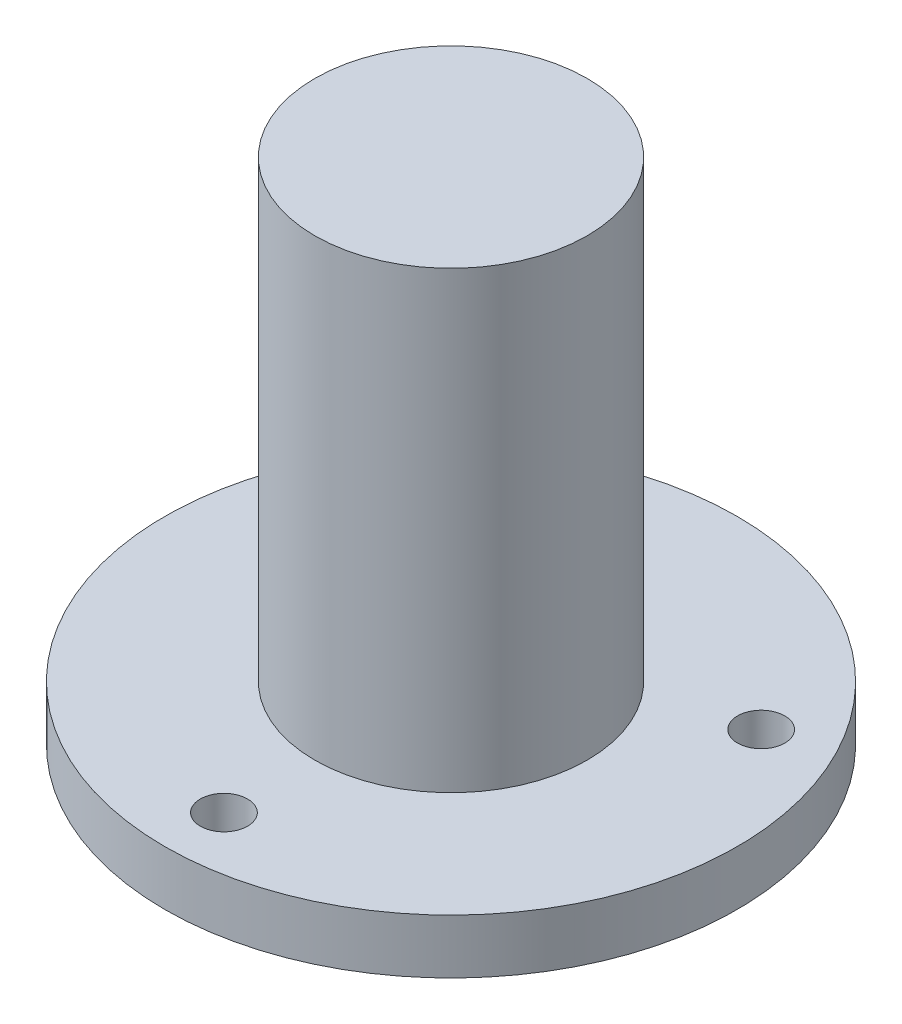
from build123d import *

# Parameters (mm, degrees)
SKETCH_1_R          = 31.5
EXTRUDE_1_DEPTH     = 6
SKETCH_2_R          = 15
EXTRUDE_2_DEPTH     = 50
SKETCH_3_R          = 2.6
CUT_EXTRUDE_1_DEPTH = 72.557669051


with BuildPart() as part:
    # 草图1 → 凸台-拉伸1 (new body)
    with BuildSketch(Plane(origin=(0, 0, 0), x_dir=(1, 0, 0), z_dir=(0, 1, 0))):
        with Locations(Location((0, 0, 0), (0, 0, 270))):
            Circle(SKETCH_1_R)
    extrude(amount=EXTRUDE_1_DEPTH)

    # 草图2 → 凸台-拉伸2 (add)
    with BuildSketch(Plane(origin=(0, 6, 0), x_dir=(1, 0, 0), z_dir=(0, 1, 0))):
        with Locations(Location((0, 0, 0), (0, 0, 270))):
            Circle(SKETCH_2_R)
    extrude(amount=EXTRUDE_2_DEPTH)

    # 草图3 → 切除-拉伸1 (cut, through all)
    with BuildSketch(Plane.XZ):
        with Locations(Location((-21.650635095, -12.5, 0), (0, 0, 270))):
            Circle(SKETCH_3_R)
        with Locations(Location((0, 25, 0), (0, 0, 270))):
            Circle(SKETCH_3_R)
        with Locations(Location((21.650635095, -12.5, 0), (0, 0, 270))):
            Circle(SKETCH_3_R)
    extrude(amount=-CUT_EXTRUDE_1_DEPTH, mode=Mode.SUBTRACT)


solid = part.part
